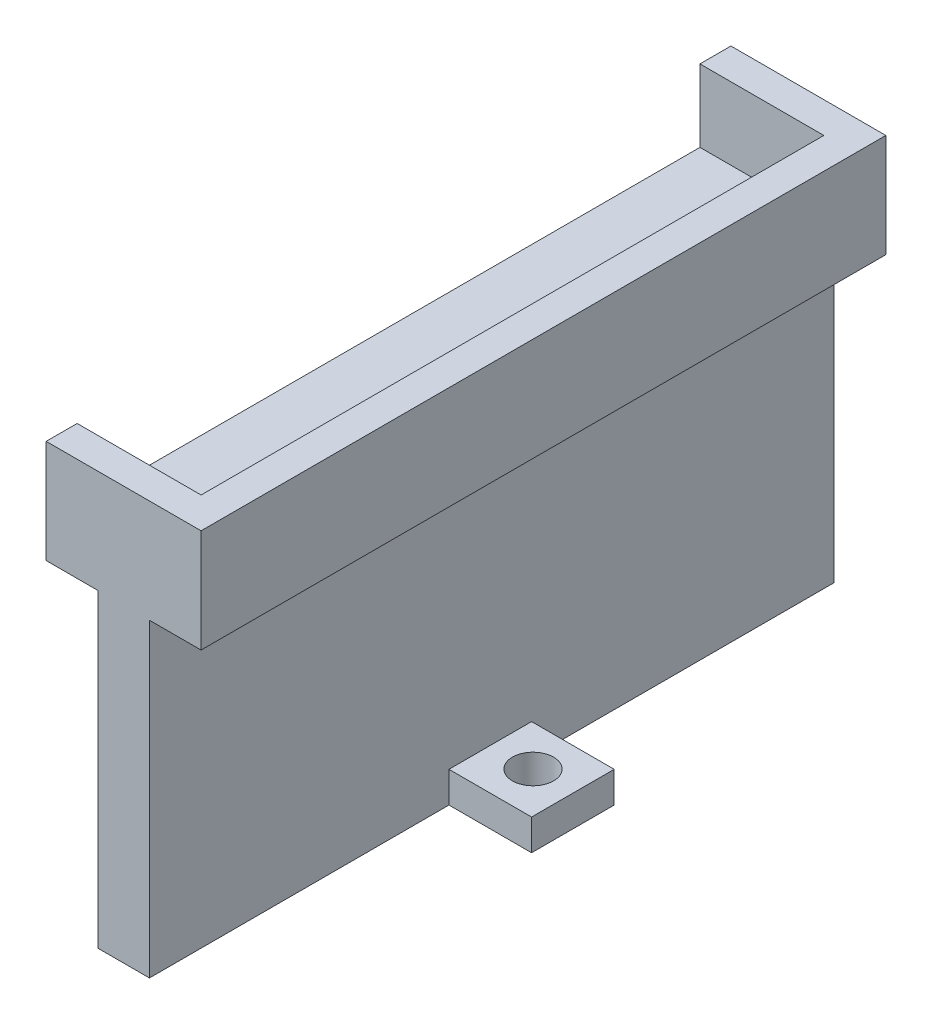
from build123d import *

# Parameters (mm, degrees)
SKETCH1_W               = 177
SKETCH1_H               = 66.3
BOSS_EXTRUDE1_DEPTH     = 10
CUT_EXTRUDE1_DEPTH      = 120.991628317
CUT_EXTRUDE1_DEPTH_BACK = 7
SKETCH2_W               = 171
SKETCH2_H               = 60.3
SKETCH3_W               = 5
SKETCH3_H               = 66.3
BOSS_EXTRUDE2_DEPTH     = 30
SKETCH4_W               = 147
SKETCH4_H               = 66.3
CUT_EXTRUDE2_DEPTH      = 30
SKETCH5_W               = 8
SKETCH5_H               = 8
SKETCH5_R               = 1.899919422
SKETCH5_R_2             = 1.99416254
BOSS_EXTRUDE3_DEPTH     = 3
SKETCH6_W               = 53.200668984
SKETCH6_H               = 118.475248661
CUT_EXTRUDE3_DEPTH      = 137.93353889


with BuildPart() as part:
    # Sketch1 → Boss-Extrude1 (new body)
    with BuildSketch(Plane(origin=(0, 0, 0), x_dir=(1, 0, 0), z_dir=(0, 1, 0))):
        with Locations((-24.496138181, -5.963471112)):
            Rectangle(SKETCH1_W, SKETCH1_H)
    extrude(amount=BOSS_EXTRUDE1_DEPTH)

    # Sketch2 → Cut-Extrude1 (cut, two sides: drawn at the far end of the back side and taken through both)
    with BuildSketch(Plane(origin=(0, 10, 0), x_dir=(1, 0, 0), z_dir=(0, 1, 0)).offset(-CUT_EXTRUDE1_DEPTH_BACK)):
        with Locations((-24.496138181, -5.963471112)):
            Rectangle(SKETCH2_W, SKETCH2_H)
    extrude(amount=CUT_EXTRUDE1_DEPTH + CUT_EXTRUDE1_DEPTH_BACK, mode=Mode.SUBTRACT)

    # Sketch3 → Boss-Extrude2 (add)
    with BuildSketch(Plane.XZ):
        with Locations((-105.496138181, 5.963471112)):
            Rectangle(SKETCH3_W, SKETCH3_H)
        with Locations((56.503861819, 5.963471112)):
            Rectangle(SKETCH3_W, SKETCH3_H)
    extrude(amount=BOSS_EXTRUDE2_DEPTH)

    # Sketch4 → Cut-Extrude2 (cut)
    with BuildSketch(Plane.XZ):
        with Locations((-24.496138181, 5.963471112)):
            Rectangle(SKETCH4_W, SKETCH4_H)
    extrude(amount=-CUT_EXTRUDE2_DEPTH, mode=Mode.SUBTRACT)


with BuildPart() as cut_extrude2_piece_1:
    # of the separate pieces the step leaves, piece 1, a body of its own (cut_extrude2_pieces)
    add(part.part.solids().sort_by_distance((-97.996138181, 0, 39.113471112))[0])



with BuildPart() as cut_extrude2_piece_2:
    # of the separate pieces the step leaves, piece 2, a body of its own (cut_extrude2_pieces)
    add(part.part.solids().sort_by_distance((64.003861819, 0, 39.113471112))[0])


with BuildPart() as cut_extrude2_piece_1_1:
    add(cut_extrude2_piece_1.part)

    add(cut_extrude2_piece_2.part)  # Boss-Extrude3 merges Cut-Extrude2 piece 2
    # Sketch5 → Boss-Extrude3 (add)
    # profile 1 of 2: a face of its own
    with BuildSketch(Plane.XZ.offset(30)):
        with Locations((-111.996138181, 6.113471112)):
            Rectangle(SKETCH5_W, SKETCH5_H)
        with Locations(Location((-111.976969615, 5.996435965, 0), (0, 0, 270))):
            Circle(SKETCH5_R, mode=Mode.SUBTRACT)
    # profile 2 of 2: a face of its own
    with BuildSketch(Plane.XZ.offset(30)):
        with Locations((63.003861819, 6.113471112)):
            Rectangle(SKETCH5_W, SKETCH5_H)
        with Locations(Location((63.046032676, 6.021165831, 0), (0, 0, 270))):
            Circle(SKETCH5_R_2, mode=Mode.SUBTRACT)
    extrude(amount=-BOSS_EXTRUDE3_DEPTH)

    # Sketch6 → Cut-Extrude3 (cut, through all)
    with BuildSketch(Plane(origin=(0, 0, -27.186528888), x_dir=(-1, 0, 0), z_dir=(0, 0, -1))):
        with Locations((95.157985418, 15.958745635)):
            Rectangle(SKETCH6_W, SKETCH6_H)
    extrude(amount=-CUT_EXTRUDE3_DEPTH, mode=Mode.SUBTRACT)


solid = cut_extrude2_piece_1_1.part
